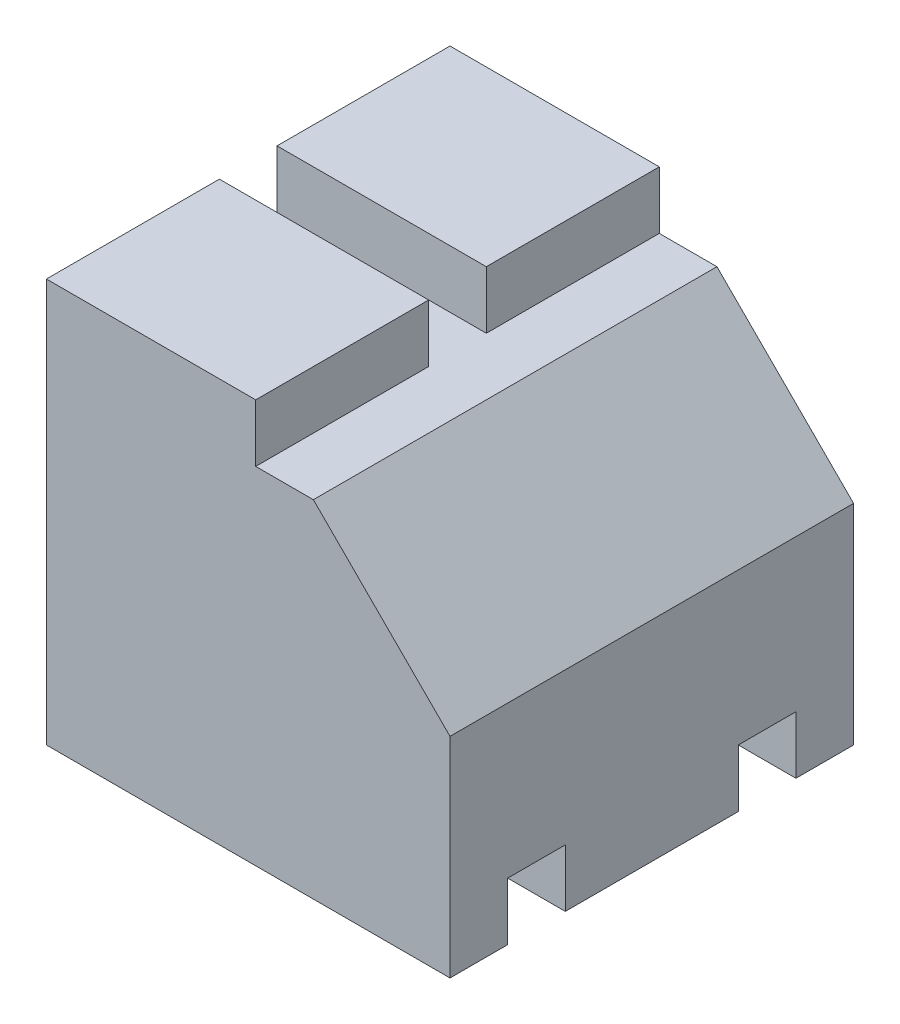
from build123d import *

# Parameters (mm, degrees)
CROQUIS1_W                 = 70
CROQUIS1_H                 = 70
SALIENTE_EXTRUIR1_DEPTH    = 70
CORTAR_EXTRUIR1_DEPTH      = 122.24355653
CORTAR_EXTRUIR1_DEPTH_BACK = 70
CROQUIS3_W                 = 10
CROQUIS3_H                 = 10
CORTAR_EXTRUIR2_DEPTH      = 70
CORTAR_EXTRUIR3_DEPTH      = 122.24355653
CORTAR_EXTRUIR3_DEPTH_BACK = 122.24355653
CORTAR_EXTRUIR4_DEPTH      = 106.44045021
CORTAR_EXTRUIR4_DEPTH_BACK = 106.44045021
CROQUIS5_W                 = 10
CROQUIS5_H                 = 10


with BuildPart() as part:
    # Croquis1 → Saliente-Extruir1 (new body)
    with BuildSketch(Plane(origin=(0, 0, 0), x_dir=(0, 0, -1), z_dir=(1, 0, 0))):
        with Locations((-35, 35)):
            Rectangle(CROQUIS1_W, CROQUIS1_H)
    extrude(amount=SALIENTE_EXTRUIR1_DEPTH)

    # Croquis2 → Cortar-Extruir1 (cut, two sides: drawn at the far end of the back side and taken through both)
    with BuildSketch(Plane.XY.offset(70).offset(-CORTAR_EXTRUIR1_DEPTH_BACK)):
        Polygon((-82.285109819, 188.585089714), (36.299979895, 70), (70, 36.299979895), (188.585089714, -82.285109819), (425.755269142, 154.885069609), (154.885069609, 425.755269142), align=None)
    extrude(amount=CORTAR_EXTRUIR1_DEPTH + CORTAR_EXTRUIR1_DEPTH_BACK, mode=Mode.SUBTRACT)

    # Croquis3 → Cortar-Extruir2 (cut)
    with BuildSketch(Plane(origin=(70, 0, 0), x_dir=(0, 0, -1), z_dir=(1, 0, 0))):
        with Locations((-15, 5)):
            Rectangle(CROQUIS3_W, CROQUIS3_H)
        with Locations((-55, 5)):
            Rectangle(CROQUIS3_W, CROQUIS3_H)
    extrude(amount=-CORTAR_EXTRUIR2_DEPTH, mode=Mode.SUBTRACT)

    # Croquis4 → Cortar-Extruir3 (cut, two sides: drawn at the far end of the back side and taken through both)
    with BuildSketch(Plane.XY.offset(70).offset(-CORTAR_EXTRUIR3_DEPTH_BACK)):
        Polygon((36.299979895, 237.704642169), (36.299979895, 70), (36.299979895, 60), (46.299979895, 60), (214.004622064, 60), (451.174801491, 297.170179428), (273.470159323, 474.874821596), align=None)
    extrude(amount=CORTAR_EXTRUIR3_DEPTH + CORTAR_EXTRUIR3_DEPTH_BACK, mode=Mode.SUBTRACT)

    # Croquis5 → Cortar-Extruir4 (cut, two sides: drawn at the far end of the back side and taken through both)
    with BuildSketch(Plane(origin=(36.299979895, 0, 0), x_dir=(0, 0, -1), z_dir=(1, 0, 0)).offset(-CORTAR_EXTRUIR4_DEPTH_BACK)):
        with Locations((-35, 65)):
            Rectangle(CROQUIS5_W, CROQUIS5_H)
    extrude(amount=CORTAR_EXTRUIR4_DEPTH + CORTAR_EXTRUIR4_DEPTH_BACK, mode=Mode.SUBTRACT)


solid = part.part
